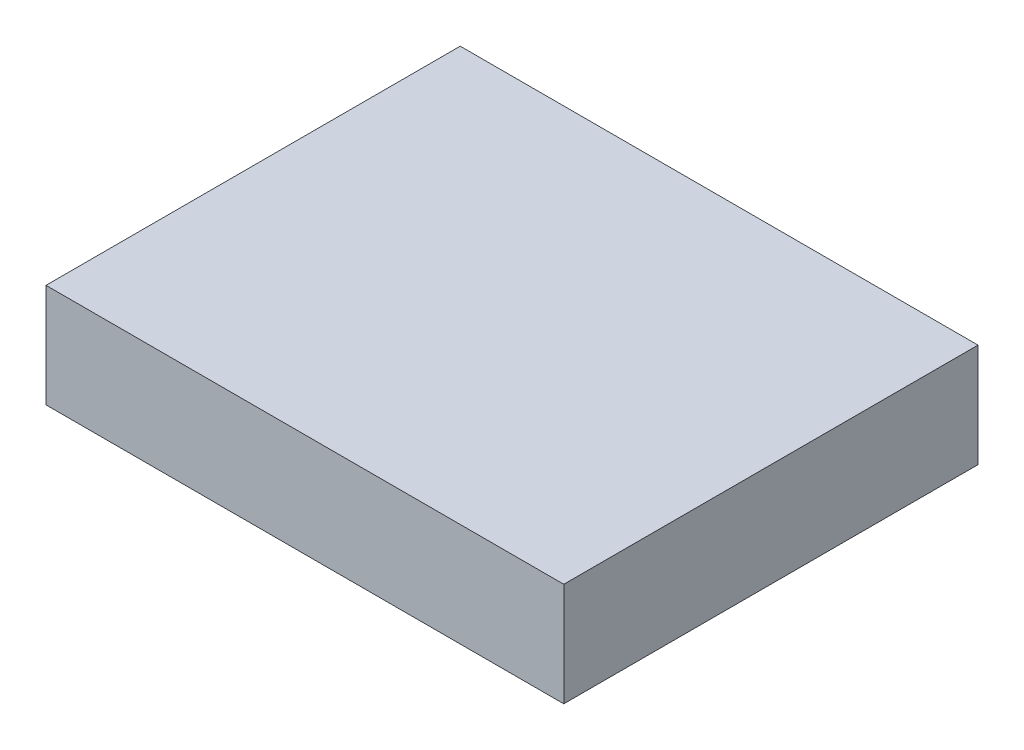
from build123d import *

# Parameters (mm, degrees)
SKETCH1_W           = 15
SKETCH1_H           = 12
BOSS_EXTRUDE1_DEPTH = 3


with BuildPart() as part:
    # Sketch1 → Boss-Extrude1 (new body)
    with BuildSketch(Plane(origin=(0, 0, 0), x_dir=(1, 0, 0), z_dir=(0, 1, 0))):
        with Locations((-7.5, -6)):
            Rectangle(SKETCH1_W, SKETCH1_H)
    extrude(amount=BOSS_EXTRUDE1_DEPTH)


solid = part.part
